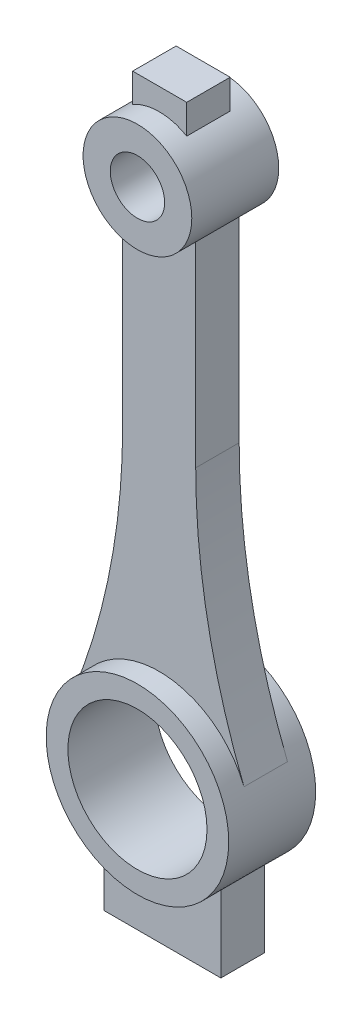
from build123d import *

# Parameters (mm, degrees)
SKETCH2_R             = 21
SKETCH2_R_2           = 16
BOSS_EXTRUDE1_DEPTH   = 10
SKETCH2_R_3           = 12.5
SKETCH2_R_4           = 6.25
BOSS_EXTRUDE1_2_DEPTH = 10
BOSS_EXTRUDE2_DEPTH   = 5


with BuildPart() as part:
    # Sketch2 → Boss-Extrude1 (new, symmetric)
    with BuildSketch(Plane.XY):
        with Locations((0, -43.810288723)):
            Circle(SKETCH2_R)
        with Locations((0, -43.810288723)):
            Circle(SKETCH2_R_2, mode=Mode.SUBTRACT)
    extrude(amount=BOSS_EXTRUDE1_DEPTH, both=True)



with BuildPart() as body_2:
    # Sketch2 → Boss-Extrude1 2 (new, symmetric)
    with BuildSketch(Plane.XY):
        with Locations((0, 76.189711277)):
            Circle(SKETCH2_R_3)
        with Locations((0, 76.189711277)):
            Circle(SKETCH2_R_4, mode=Mode.SUBTRACT)
    extrude(amount=BOSS_EXTRUDE1_2_DEPTH, both=True)


with BuildPart() as part_1:
    add(part.part)

    add(body_2.part)  # Boss-Extrude2 merges body 2
    # Sketch2<3> → Boss-Extrude2 (add, symmetric)
    with BuildSketch(Plane.XY):
        with BuildLine():
            ThreePointArc((14.185268549, -59.295060475), (1.002030285, -64.786368798), (-12.644623669, -60.576728186))
            Line((-12.644623669, -60.576728186), (-12.644623669, -76.805395819))
            Line((-12.644623669, -76.805395819), (14.185268549, -76.805395819))
            Line((14.185268549, -76.805395819), (14.185268549, -59.295060475))
        make_face()
        with BuildLine():
            ThreePointArc((-8.40143978, 21.934128658), (-11.204201439, -7.583899174), (-19.512314514, -36.046940071))
            ThreePointArc((-19.512314514, -36.046940071), (0, -22.810288723), (19.512314514, -36.046940071))
            ThreePointArc((19.512314514, -36.046940071), (11.204201439, -7.583899174), (8.40143978, 21.934128658))
            Line((8.40143978, 21.934128658), (8.40143978, 66.934128658))
            ThreePointArc((8.40143978, 66.934128658), (0, 63.689711277), (-8.40143978, 66.934128658))
            Line((-8.40143978, 66.934128658), (-8.40143978, 21.934128658))
        make_face()
        with BuildLine():
            Line((-6.10309837, 93.714824033), (-6.10309837, 87.098523783))
            ThreePointArc((-6.10309837, 87.098523783), (0.131172403, 88.68902301), (6.330691245, 86.968038993))
            Line((6.330691245, 86.968038993), (6.330691245, 93.714824033))
            Line((6.330691245, 93.714824033), (-6.10309837, 93.714824033))
        make_face()
    extrude(amount=BOSS_EXTRUDE2_DEPTH, both=True)


solid = part_1.part
